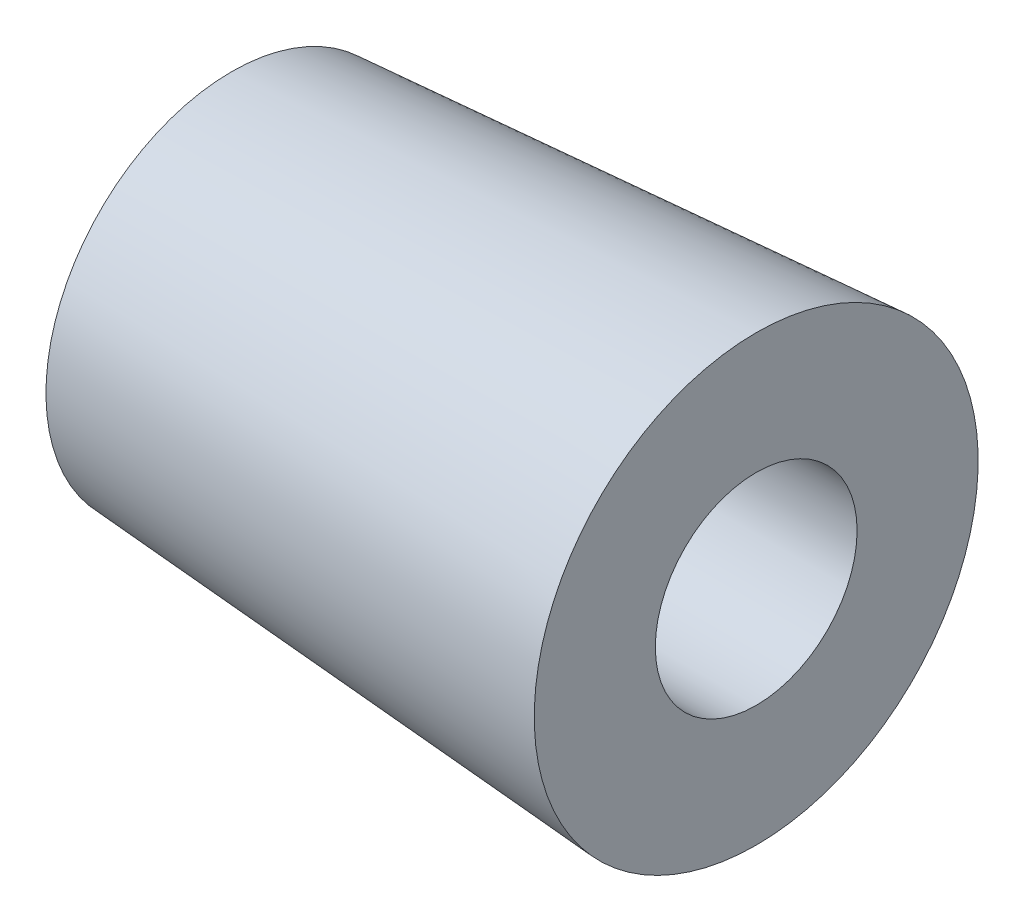
from build123d import *

# Parameters (mm, degrees)
REVOLVE1_ANGLE = 359.999999589


with BuildPart() as part:
    # Sketch1 → Revolve1 (revolve)
    with BuildSketch(Plane.XY):
        Polygon((4800, 250), (4800, 460), (6100, 550), (6100, 250), align=None)
    revolve(axis=Axis((0, 0, 0), (1, 0, 0)), revolution_arc=REVOLVE1_ANGLE)


solid = part.part
